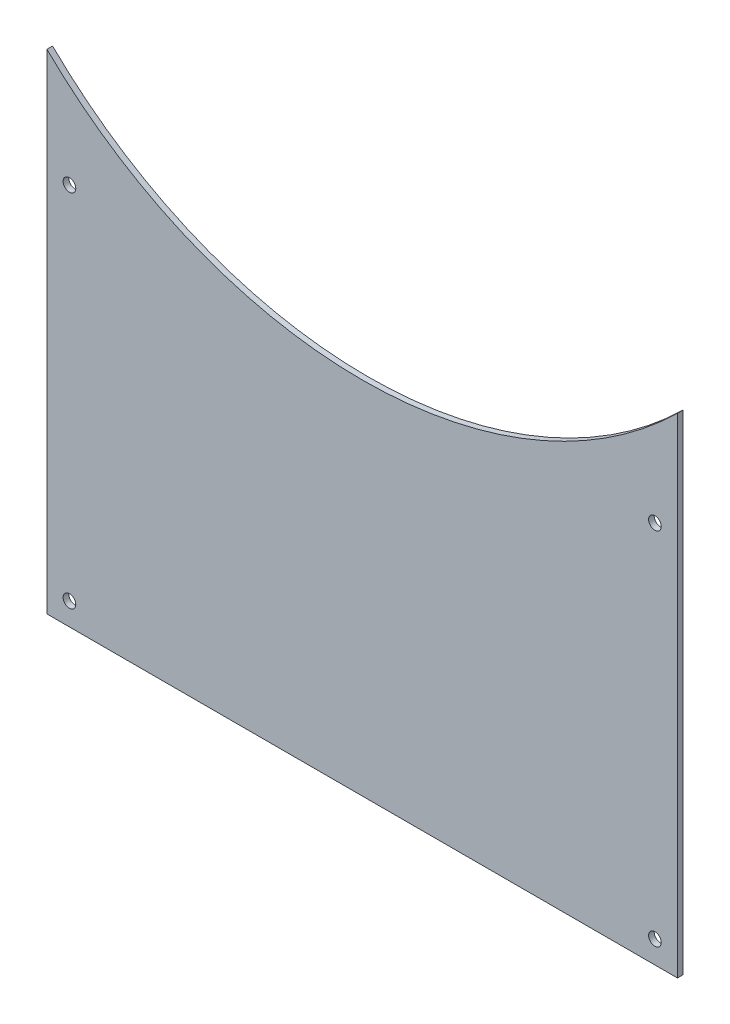
from build123d import *

# Parameters (mm, degrees)
SKETCH1_W               = 355.6
SKETCH1_H               = 279.4
BOSS_EXTRUDE1_DEPTH     = 3.175
F_1_4_CLEARANCE_HOLE1_D = 7.14248
CUT_EXTRUDE1_REACH      = 454.245
SKETCH4_R               = 254


with BuildPart() as part:
    # Sketch1 → Boss-Extrude1 (new body)
    with BuildSketch(Plane.XY):
        with Locations((177.8, -139.7)):
            Rectangle(SKETCH1_W, SKETCH1_H)
    extrude(amount=BOSS_EXTRUDE1_DEPTH)

    # 1/4 Clearance Hole1 (through all)
    with Locations(Plane.XY.offset(3.175)):
        with Locations((342.9, -63.5), (342.9, -266.7), (12.7, -266.7), (12.7, -63.5)):
            Hole(F_1_4_CLEARANCE_HOLE1_D / 2)

    # Sketch4 → Cut-Extrude1 (cut, up to next)
    with BuildSketch(Plane.XY.offset(3.175), mode=Mode.PRIVATE) as cut_extrude1_sk1:
        with Locations((177.8, 177.8)):
            Circle(SKETCH4_R)
    cut_extrude1_tool1 = extrude(cut_extrude1_sk1.sketch, amount=-CUT_EXTRUDE1_REACH, mode=Mode.PRIVATE) & part.part
    add(cut_extrude1_tool1.solids().sort_by_distance((177.8, 177.8, 3.175))[0], mode=Mode.SUBTRACT)


solid = part.part
